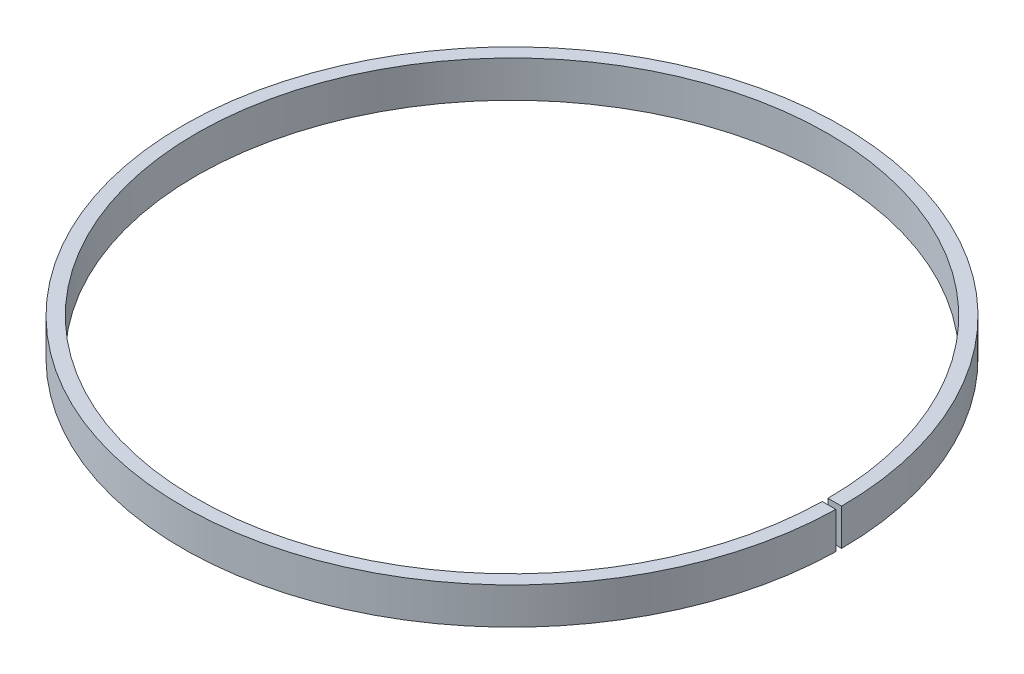
from build123d import *

# Parameters (mm, degrees)
SKETCH1_W     = 2.3622
SKETCH1_H     = 6.35
PISTON1_ANGLE = 359


with BuildPart() as part:
    # Sketch1 → Piston1 (revolve)
    with BuildSketch(Plane.XY):
        with Locations((55.9562, 3.175)):
            Rectangle(SKETCH1_W, SKETCH1_H)
    revolve(axis=Axis((0, 0, 0), (0, 1, 0)), revolution_arc=PISTON1_ANGLE)


solid = part.part
